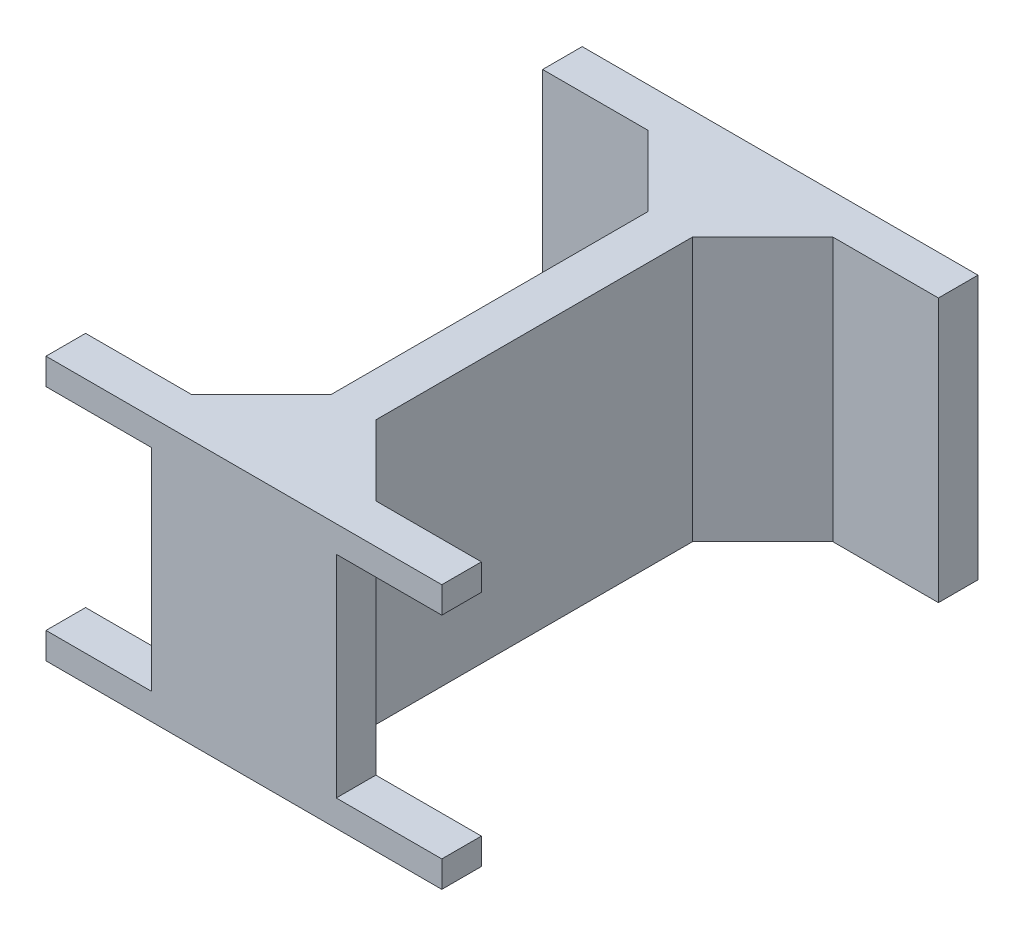
from build123d import *

# Parameters (mm, degrees)
SKETCH2_W           = 75
SKETCH2_H           = 50
BOSS_EXTRUDE1_DEPTH = 101.6
CUT_EXTRUDE1_DEPTH  = 101.6
CUT_EXTRUDE2_DEPTH  = 101.6
SKETCH5_W           = 20
SKETCH5_H           = 40
CUT_EXTRUDE3_DEPTH  = 10
SKETCH6_W           = 20
SKETCH6_H           = 40
CUT_EXTRUDE4_DEPTH  = 10


with BuildPart() as part:
    # Sketch2 → Boss-Extrude1 (new body)
    with BuildSketch(Plane.XY):
        with Locations((-3.307692308, -6.81353022)):
            Rectangle(SKETCH2_W, SKETCH2_H)
    extrude(amount=BOSS_EXTRUDE1_DEPTH)

    # Sketch3 → Cut-Extrude1 (cut)
    with BuildSketch(Plane(origin=(0, 18.18646978, 0), x_dir=(1, 0, 0), z_dir=(0, 1, 0))):
        Polygon((-40.807692308, -7.5), (-20.807692308, -7.5), (-7.507692308, -20.8), (-7.507692308, -80.8), (-20.807692308, -94.1), (-40.807692308, -94.1), align=None)
    extrude(amount=-CUT_EXTRUDE1_DEPTH, mode=Mode.SUBTRACT)

    # Sketch4 → Cut-Extrude2 (cut)
    with BuildSketch(Plane(origin=(0, 18.18646978, 0), x_dir=(1, 0, 0), z_dir=(0, 1, 0))):
        Polygon((34.192307692, -94.1), (14.192307692, -94.1), (0.892307692, -80.8), (0.892307692, -20.8), (14.192307692, -7.5), (34.192307692, -7.5), align=None)
    extrude(amount=-CUT_EXTRUDE2_DEPTH, mode=Mode.SUBTRACT)

    # Sketch5 → Cut-Extrude3 (cut)
    with BuildSketch(Plane.XY.offset(101.6)):
        with Locations((24.192307692, -6.81353022)):
            Rectangle(SKETCH5_W, SKETCH5_H)
    extrude(amount=-CUT_EXTRUDE3_DEPTH, mode=Mode.SUBTRACT)

    # Sketch6 → Cut-Extrude4 (cut)
    with BuildSketch(Plane.XY.offset(101.6)):
        with Locations((-30.807692308, -6.81353022)):
            Rectangle(SKETCH6_W, SKETCH6_H)
    extrude(amount=-CUT_EXTRUDE4_DEPTH, mode=Mode.SUBTRACT)


solid = part.part
